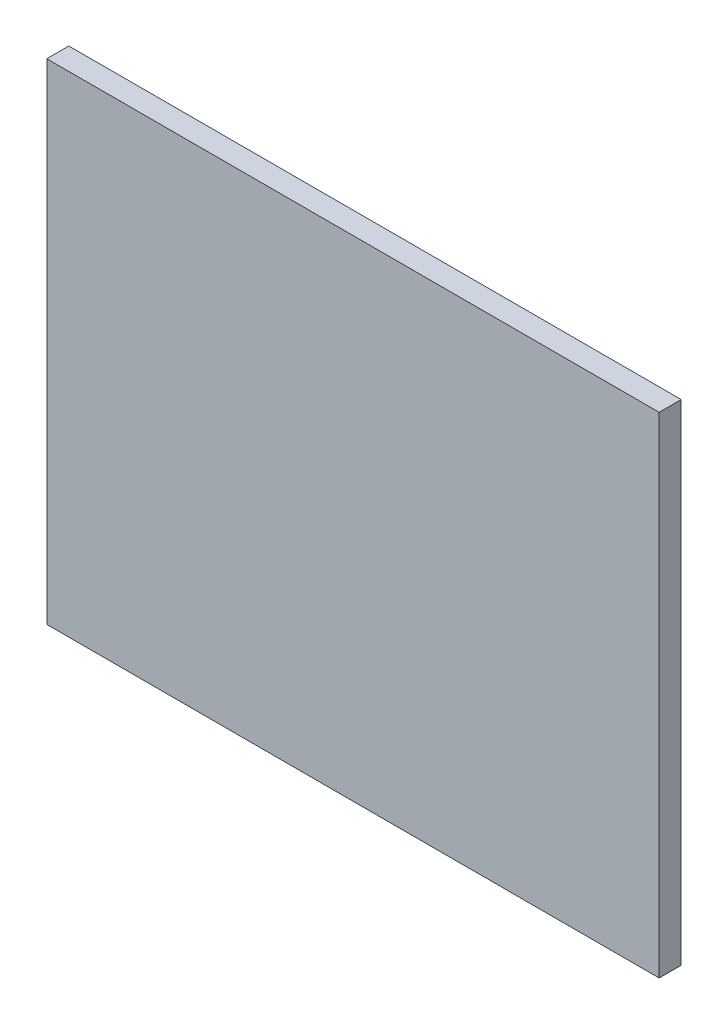
from build123d import *

# Parameters (mm, degrees)
SCHIZZO1_W                   = 500
SCHIZZO1_H                   = 400
ESTRUSIONE_ESTRUSIONE1_DEPTH = 18


with BuildPart() as part:
    # Schizzo1 → Estrusione-Estrusione1 (new body)
    with BuildSketch(Plane.XY):
        Rectangle(SCHIZZO1_W, SCHIZZO1_H)
    extrude(amount=ESTRUSIONE_ESTRUSIONE1_DEPTH)


solid = part.part
